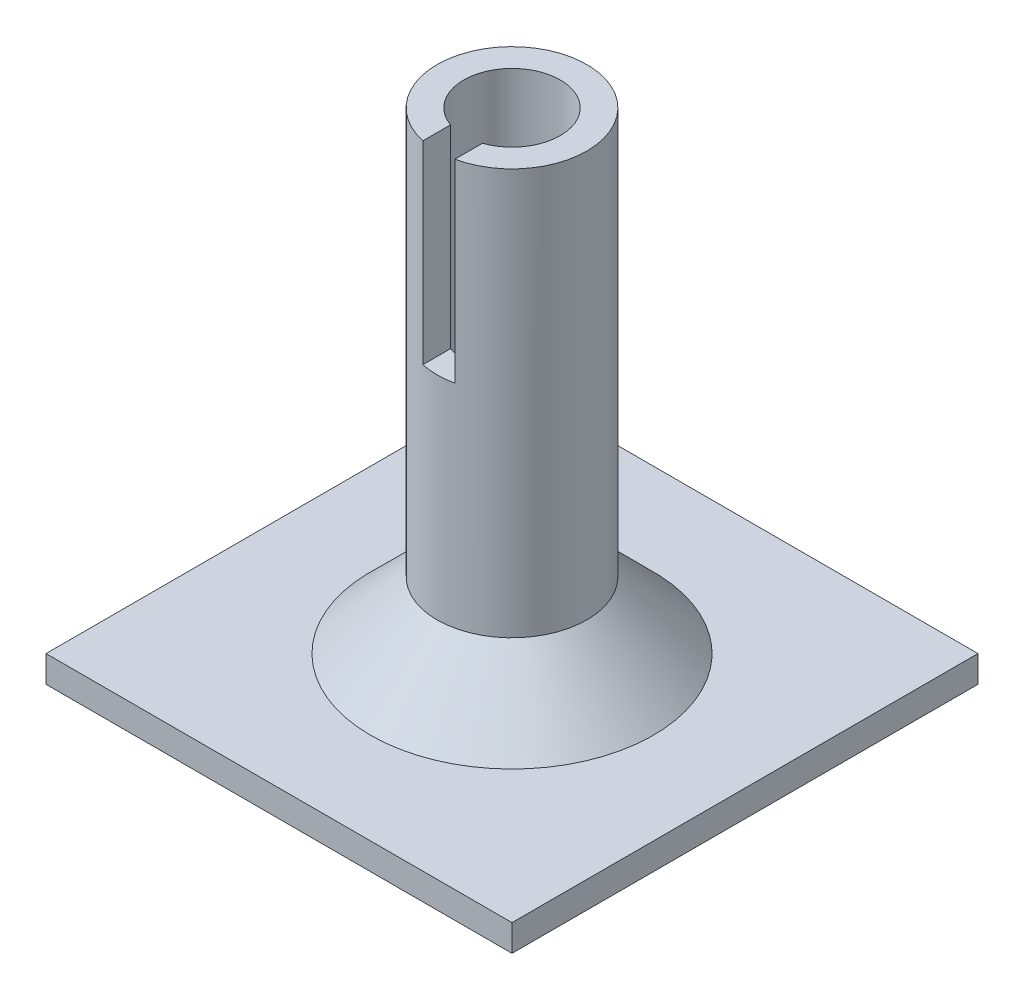
from build123d import *

# Parameters (mm, degrees)
SKETCH2_R           = 11.25
SKETCH2_R_2         = 7.25
BOSS_EXTRUDE1_DEPTH = 71
SKETCH2_6_W         = 70
SKETCH2_6_H         = 70
BOSS_EXTRUDE2_DEPTH = 4
CHAMFER1_SIZE       = 10
SKETCH6_W           = 4.8
SKETCH6_H           = 29.123834
CUT_EXTRUDE2_DEPTH  = 25


with BuildPart() as part:
    # Sketch2 → Boss-Extrude1 (new body)
    with BuildSketch(Plane(origin=(0, 0, 0), x_dir=(1, 0, 0), z_dir=(0, 1, 0))):
        Circle(SKETCH2_R)
        Circle(SKETCH2_R_2, mode=Mode.SUBTRACT)
    extrude(amount=BOSS_EXTRUDE1_DEPTH)

    # Sketch2<6> → Boss-Extrude2 (add)
    with BuildSketch(Plane(origin=(0, 0, 0), x_dir=(1, 0, 0), z_dir=(0, 1, 0))):
        Rectangle(SKETCH2_6_W, SKETCH2_6_H)
    extrude(amount=-BOSS_EXTRUDE2_DEPTH)

    # Chamfer1
    chamfer1_edges = [part.edges().sort_by_distance(p)[0] for p in [
        (-11.25, 0, 0),
    ]]
    chamfer(chamfer1_edges, length=CHAMFER1_SIZE)

    # Sketch6 → Cut-Extrude2 (cut)
    with BuildSketch(Plane.XY):
        with Locations((0, 56.438083)):
            Rectangle(SKETCH6_W, SKETCH6_H)
    extrude(amount=CUT_EXTRUDE2_DEPTH, mode=Mode.SUBTRACT)


solid = part.part
